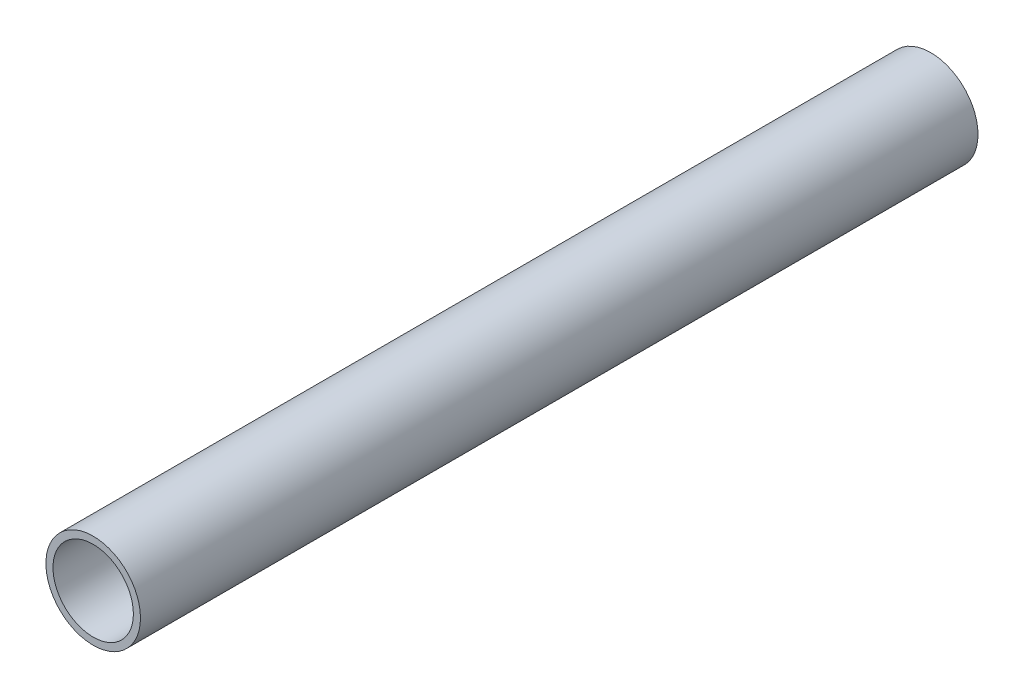
from build123d import *

# Parameters (mm, degrees)
ESBO_O1_R                = 12.7
ESBO_O1_R_2              = 10.8
RESSALTO_EXTRUS_O1_DEPTH = 225


with BuildPart() as part:
    # Esboço1 → Ressalto-extrusão1 (new body)
    with BuildSketch(Plane.XY):
        Circle(ESBO_O1_R)
        Circle(ESBO_O1_R_2, mode=Mode.SUBTRACT)
    extrude(amount=RESSALTO_EXTRUS_O1_DEPTH)


solid = part.part
